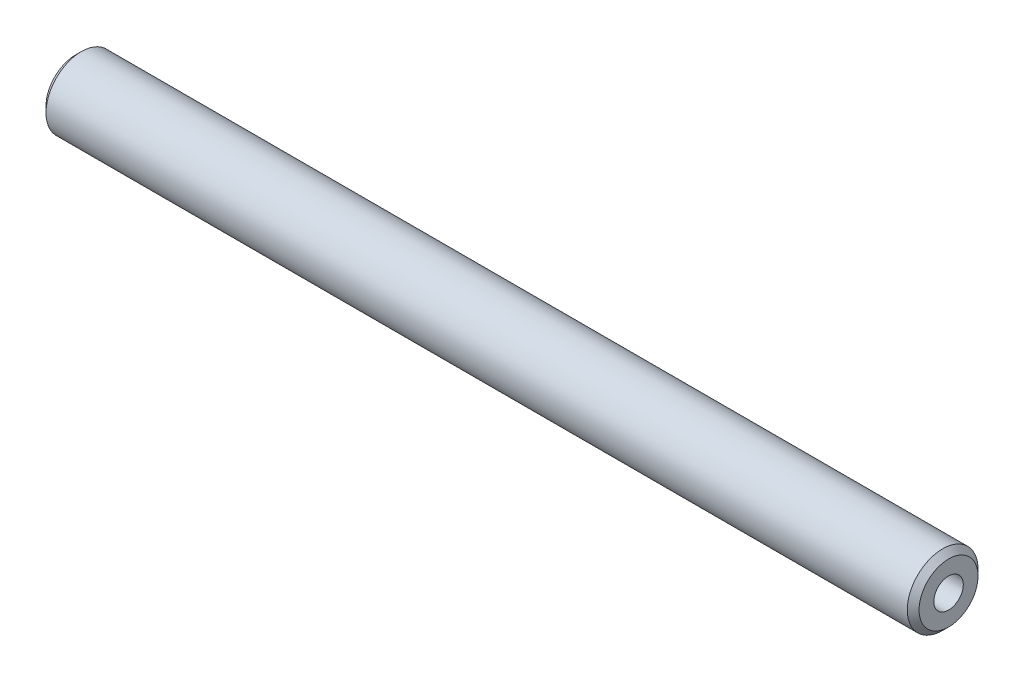
from build123d import *

# Parameters (mm, degrees)
SKETCH1_W          = 74
SKETCH1_H          = 3
TAPPED_HOLE1_D     = 2.5
TAPPED_HOLE1_DEPTH = 8.5
TAPPED_HOLE1_TIP   = 0.751075774
TAPPED_HOLE2_D     = 2.5
TAPPED_HOLE2_DEPTH = 8.5
TAPPED_HOLE2_TIP   = 0.751075774
CHAMFER1_SIZE      = 0.5


with BuildPart() as part:
    # Sketch1 → Revolve1 (revolve)
    with BuildSketch(Plane.XY):
        with Locations((37, 1.5)):
            Rectangle(SKETCH1_W, SKETCH1_H)
    revolve(axis=Axis((0, 0, 0), (1, 0, 0)))

    # Tapped Hole1
    with Locations(Plane.ZY):
        with Locations((0, 0)):
            Hole(TAPPED_HOLE1_D / 2, depth=TAPPED_HOLE1_DEPTH)
            with Locations((0, 0, -(TAPPED_HOLE1_DEPTH + TAPPED_HOLE1_TIP / 2))):  # 118° drill point
                Cone(0, TAPPED_HOLE1_D / 2, TAPPED_HOLE1_TIP, mode=Mode.SUBTRACT)

    # Tapped Hole2
    with Locations(Plane(origin=(74, 0, 0), x_dir=(0, 0, -1), z_dir=(1, 0, 0))):
        with Locations((0, 0)):
            Hole(TAPPED_HOLE2_D / 2, depth=TAPPED_HOLE2_DEPTH)
            with Locations((0, 0, -(TAPPED_HOLE2_DEPTH + TAPPED_HOLE2_TIP / 2))):  # 118° drill point
                Cone(0, TAPPED_HOLE2_D / 2, TAPPED_HOLE2_TIP, mode=Mode.SUBTRACT)

    # Chamfer1
    chamfer1_edges = [part.edges().sort_by_distance(p)[0] for p in [
        (0, -3, 0),
        (74, -3, 0),
    ]]
    chamfer(chamfer1_edges, length=CHAMFER1_SIZE)


solid = part.part
